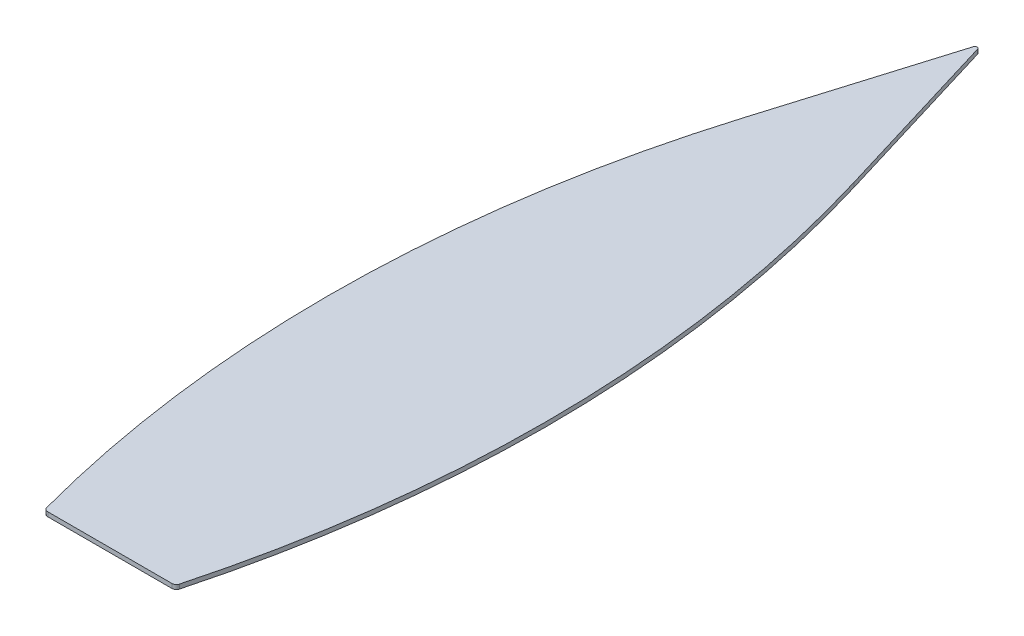
from build123d import *

# Parameters (mm, degrees)
BOSS_EXTRUDE1_DEPTH = 5
FILLET1_R           = 5
FILLET2_R           = 2.5


with BuildPart() as part:
    # Sketch1 → Boss-Extrude1 (new body)
    with BuildSketch(Plane(origin=(0, 0, 0), x_dir=(1, 0, 0), z_dir=(0, 1, 0))):
        with BuildLine():
            Line((-75, -500), (75, -500))
            ThreePointArc((75, -500), (124.853709924, -104.537010412), (63.713442869, 289.338904404))
            Line((63.713442869, 289.338904404), (0, 500))
            Line((0, 500), (-63.713442869, 289.338904404))
            ThreePointArc((-63.713442869, 289.338904404), (-124.853709924, -104.537010412), (-75, -500))
        make_face()
    extrude(amount=BOSS_EXTRUDE1_DEPTH)

    # Fillet1
    fillet1_edges = [part.edges().sort_by_distance(p)[0] for p in [
        (75, 2.5, 500),
        (-75, 2.5, 500),
    ]]
    fillet(fillet1_edges, radius=FILLET1_R)

    # Fillet2
    fillet2_edges = [part.edges().sort_by_distance(p)[0] for p in [
        (0, 2.5, -500),
    ]]
    fillet(fillet2_edges, radius=FILLET2_R)


solid = part.part
